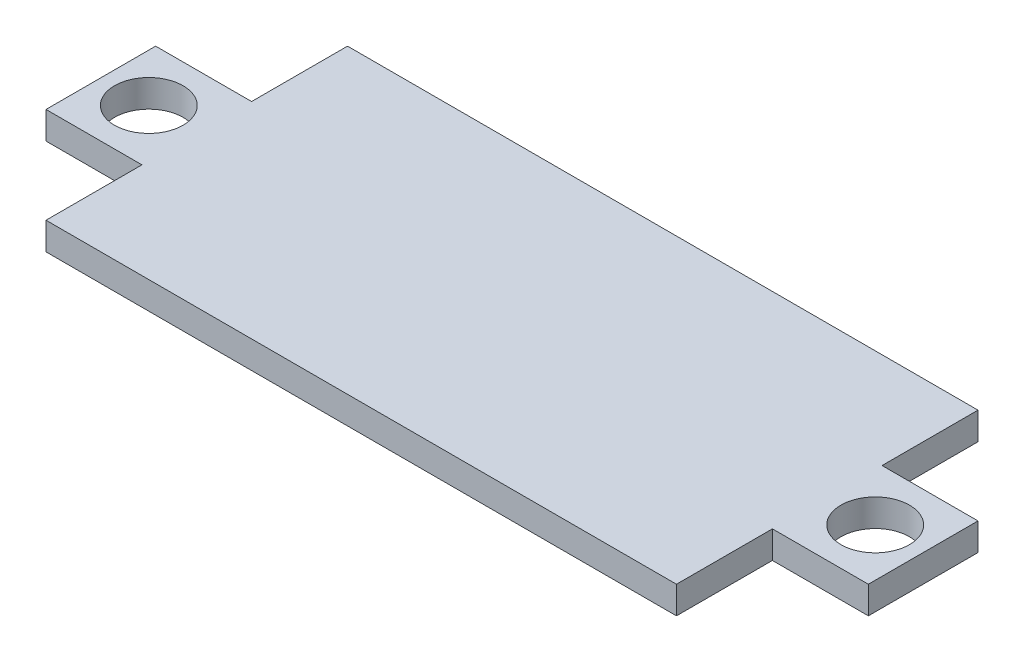
from build123d import *

# Parameters (mm, degrees)
SKETCH_1_R      = 1.25
EXTRUDE_1_DEPTH = 1


with BuildPart() as part:
    # 草图1 → 凸台-拉伸1 (new body)
    with BuildSketch(Plane(origin=(0, 0, 0), x_dir=(1, 0, 0), z_dir=(0, 1, 0))):
        Polygon((-23.460504974, 13.729886792), (-0.460504974, 13.729886792), (-0.460504974, 10.229886792), (3.039495026, 10.229886792), (3.039495026, 6.229886792), (-0.460504974, 6.229886792), (-0.460504974, 2.729886792), (-23.460504974, 2.729886792), (-23.460504974, 6.229886792), (-26.960504974, 6.229886792), (-26.960504974, 10.229886792), (-23.460504974, 10.229886792), align=None)
        with Locations(Location((1.289495026, 8.229886792, 0), (0, 0, 270))):
            Circle(SKETCH_1_R, mode=Mode.SUBTRACT)
        with Locations(Location((-25.210504974, 8.229886792, 0), (0, 0, 270))):
            Circle(SKETCH_1_R, mode=Mode.SUBTRACT)
    extrude(amount=EXTRUDE_1_DEPTH)


solid = part.part
